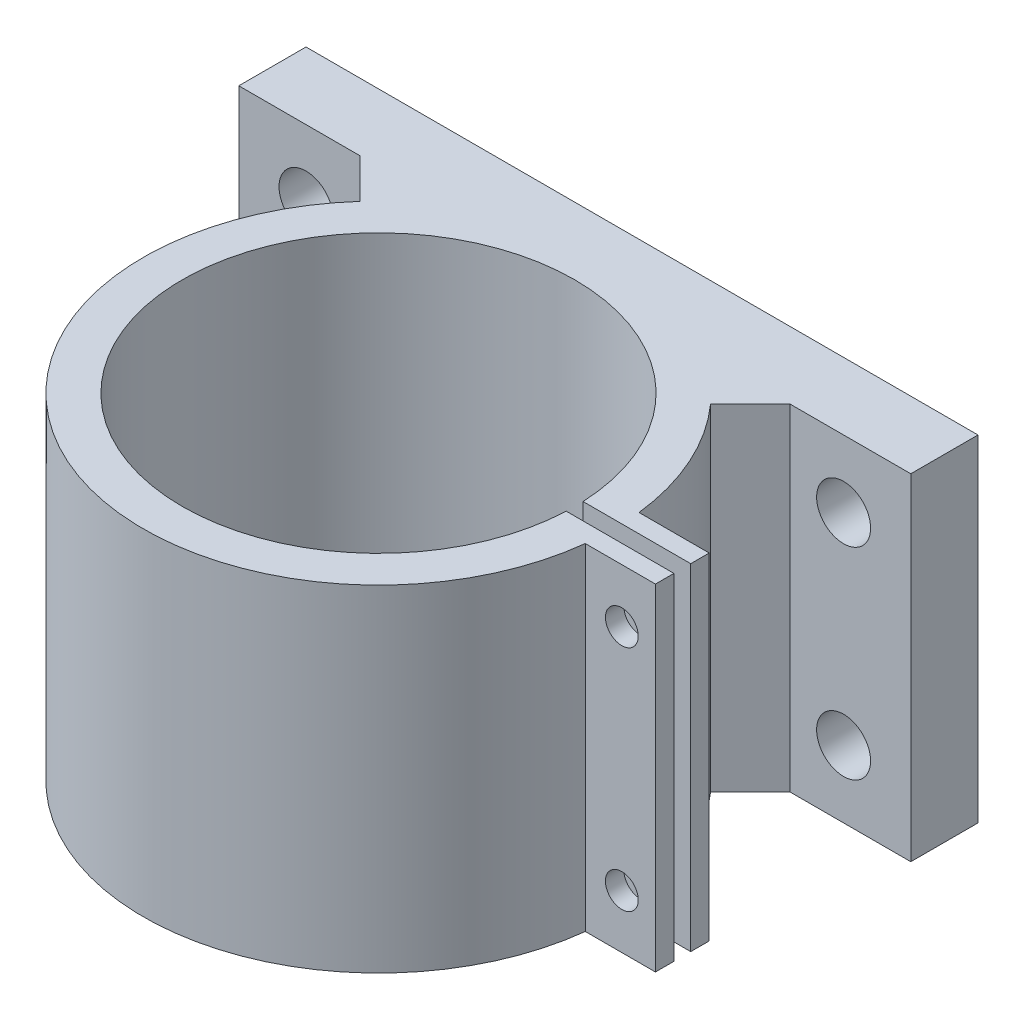
from build123d import *

# Parameters (mm, degrees)
SKETCH1_W           = 3
SKETCH1_H           = 5.08
SKETCH1_W_2         = 1.910737821
SKETCH1_W_3         = 5
SKETCH1_H_2         = 6.35
SKETCH1_W_4         = 3.175
BOSS_EXTRUDE1_DEPTH = 31.75
SKETCH2_W           = 21.412406597
SKETCH2_H           = 1.5875
CUT_EXTRUDE1_DEPTH  = 31.75
CUT_EXTRUDE2_REACH  = 54.622
SKETCH3_R           = 1.55
SKETCH4_R           = 2.55
CUT_EXTRUDE3_DEPTH  = 31.75


with BuildPart() as part:
    # Sketch1 → Boss-Extrude1 (new body)
    with BuildSketch(Plane(origin=(0, 0, 0), x_dir=(1, 0, 0), z_dir=(0, 1, 0))):
        with BuildLine():
            ThreePointArc((18.55, 0), (-13.116830791, -13.116830791), (0, 18.55))
            Line((0, 18.55), (-12.241246873, 18.55))
            ThreePointArc((-12.241246873, 18.55), (-14.529510105, 16.817965427), (-16.575509472, 14.805509472))
            ThreePointArc((-16.575509472, 14.805509472), (-9.098891287, -20.277100442), (22.079380086, -2.54))
            Line((22.079380086, -2.54), (18.55, -2.54))
            Line((18.55, -2.54), (18.55, 0))
        make_face()
        with BuildLine():
            Line((12.241246873, 18.55), (0, 18.55))
            ThreePointArc((0, 18.55), (13.116830791, 13.116830791), (18.55, 0))
            Line((18.55, 0), (18.55, 2.54))
            Line((18.55, 2.54), (22.079380086, 2.54))
            ThreePointArc((22.079380086, 2.54), (20.277100442, 9.098891287), (16.575509472, 14.805509472))
            ThreePointArc((16.575509472, 14.805509472), (14.529510105, 16.817965427), (12.241246873, 18.55))
        make_face()
        with BuildLine():
            Line((18.55, 2.54), (18.55, 0))
            Line((18.55, 0), (18.55, -2.54))
            Line((18.55, -2.54), (22.079380086, -2.54))
            ThreePointArc((22.079380086, -2.54), (22.188565157, -1.27208541), (22.225, 0))
            ThreePointArc((22.225, 0), (22.188565157, 1.27208541), (22.079380086, 2.54))
            Line((22.079380086, 2.54), (18.55, 2.54))
        make_face()
        with BuildLine():
            ThreePointArc((22.225, 0), (22.188565157, -1.27208541), (22.079380086, -2.54))
            Line((22.079380086, -2.54), (23.799262179, -2.54))
            Line((23.799262179, -2.54), (23.799262179, 2.54))
            Line((23.799262179, 2.54), (22.079380086, 2.54))
            ThreePointArc((22.079380086, 2.54), (22.188565157, 1.27208541), (22.225, 0))
        make_face()
        with Locations((25.299262179, 0)):
            Rectangle(SKETCH1_W, SKETCH1_H)
        with Locations((27.75463109, 0)):
            Rectangle(SKETCH1_W_2, SKETCH1_H)
        with BuildLine():
            Line((-20.32, 18.55), (-12.241246873, 18.55))
            ThreePointArc((-12.241246873, 18.55), (0, 22.225), (12.241246873, 18.55))
            Line((12.241246873, 18.55), (20.32, 18.55))
            Line((20.32, 18.55), (31.75, 18.55))
            Line((31.75, 18.55), (31.75, 24.9))
            Line((31.75, 24.9), (-23.575, 24.9))
            Line((-23.575, 24.9), (-23.575, 18.55))
            Line((-23.575, 18.55), (-20.32, 18.55))
        make_face()
        with BuildLine():
            Line((-12.241246873, 18.55), (0, 18.55))
            Line((0, 18.55), (12.241246873, 18.55))
            ThreePointArc((12.241246873, 18.55), (0, 22.225), (-12.241246873, 18.55))
        make_face()
        with BuildLine():
            Line((20.32, 18.55), (12.241246873, 18.55))
            ThreePointArc((12.241246873, 18.55), (14.529510105, 16.817965427), (16.575509472, 14.805509472))
            Line((16.575509472, 14.805509472), (20.32, 18.55))
        make_face()
        with BuildLine():
            ThreePointArc((-16.575509472, 14.805509472), (-14.529510105, 16.817965427), (-12.241246873, 18.55))
            Line((-12.241246873, 18.55), (-20.32, 18.55))
            Line((-20.32, 18.55), (-16.575509472, 14.805509472))
        make_face()
        with Locations((-26.075, 21.725)):
            Rectangle(SKETCH1_W_3, SKETCH1_H_2)
        with Locations((-30.1625, 21.725)):
            Rectangle(SKETCH1_W_4, SKETCH1_H_2)
    extrude(amount=BOSS_EXTRUDE1_DEPTH)

    # Sketch2 → Cut-Extrude1 (cut)
    with BuildSketch(Plane(origin=(0, 31.75, 0), x_dir=(1, 0, 0), z_dir=(0, 1, 0))):
        with Locations((22.027012195, 0)):
            Rectangle(SKETCH2_W, SKETCH2_H)
    extrude(amount=-CUT_EXTRUDE1_DEPTH, mode=Mode.SUBTRACT)

    # Cut-Extrude2: up to this face of the body (flat: up to its plane)
    cut_extrude2_end = Plane(part.part.faces().sort_by_distance((25.394690043, 15.875, -2.54))[0])
    # Sketch3 → Cut-Extrude2 (cut, up to the picked face)
    with BuildSketch(Plane.XY.offset(2.54), mode=Mode.PRIVATE) as cut_extrude2_sk1:
        with Locations((25.535, 5.08)):
            Circle(SKETCH3_R)
    cut_extrude2_tool1 = split(extrude(cut_extrude2_sk1.sketch, amount=-CUT_EXTRUDE2_REACH, mode=Mode.PRIVATE), bisect_by=cut_extrude2_end, keep=Keep.BOTH, mode=Mode.PRIVATE)
    # Sketch3 → Cut-Extrude2 (cut, up to the picked face)
    with BuildSketch(Plane.XY.offset(2.54), mode=Mode.PRIVATE) as cut_extrude2_sk2:
        with Locations((25.535, 26.67)):
            Circle(SKETCH3_R)
    cut_extrude2_tool2 = split(extrude(cut_extrude2_sk2.sketch, amount=-CUT_EXTRUDE2_REACH, mode=Mode.PRIVATE), bisect_by=cut_extrude2_end, keep=Keep.BOTH, mode=Mode.PRIVATE)
    add(cut_extrude2_tool1.solids().sort_by(Axis((25.535, 5.08, 2.54), (0, 0, -1)))[0], mode=Mode.SUBTRACT)
    add(cut_extrude2_tool2.solids().sort_by(Axis((25.535, 26.67, 2.54), (0, 0, -1)))[0], mode=Mode.SUBTRACT)

    # Sketch4 → Cut-Extrude3 (cut)
    with BuildSketch(Plane.XY.offset(-18.55)):
        with Locations((-25.4, 6.35)):
            Circle(SKETCH4_R)
        with Locations((-25.4, 25.4)):
            Circle(SKETCH4_R)
        with Locations((25.4, 25.4)):
            Circle(SKETCH4_R)
        with Locations((25.4, 6.35)):
            Circle(SKETCH4_R)
    extrude(amount=-CUT_EXTRUDE3_DEPTH, mode=Mode.SUBTRACT)


solid = part.part
